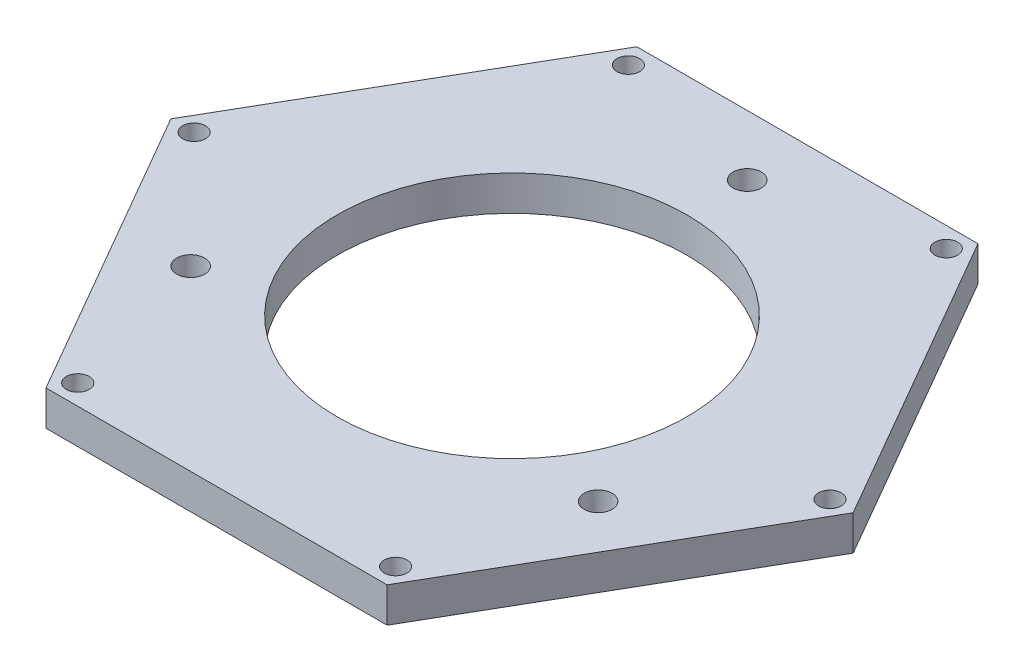
from build123d import *

# Parameters (mm, degrees)
BOSS_EXTRUDE1_DEPTH = 4
SKETCH3_R           = 20
CUT_EXTRUDE1_DEPTH  = 4
SKETCH4_R           = 1.6
SKETCH4_R_2         = 1.3
CUT_EXTRUDE2_DEPTH  = 4


with BuildPart() as part:
    # Sketch2 → Boss-Extrude1 (new body)
    with BuildSketch(Plane(origin=(0, 0, 0), x_dir=(1, 0, 0), z_dir=(0, 1, 0))):
        Polygon((1.572650536, 74.401195204), (-37.427349464, 74.401195204), (-56.927349464, 40.626204456), (-37.427349464, 6.851213708), (1.572650536, 6.851213708), (21.072650536, 40.626204456), align=None)
    extrude(amount=-BOSS_EXTRUDE1_DEPTH)

    # Sketch3 → Cut-Extrude1 (cut)
    with BuildSketch(Plane(origin=(0, 0, 0), x_dir=(1, 0, 0), z_dir=(0, 1, 0))):
        with Locations(Location((-17.927354806, 40.626195204, 0), (0, 0, 270))):
            Circle(SKETCH3_R)
    extrude(amount=-CUT_EXTRUDE1_DEPTH, mode=Mode.SUBTRACT)

    # Sketch4 → Cut-Extrude2 (cut)
    with BuildSketch(Plane(origin=(0, 0, 0), x_dir=(1, 0, 0), z_dir=(0, 1, 0))):
        with Locations(Location((5.360065631, 27.181209082, 0), (0, 0, 270))):
            Circle(SKETCH4_R)
        with Locations(Location((0.244744901, 9.15121368, 0), (0, 0, 270))):
            Circle(SKETCH4_R_2)
        with Locations(Location((-36.099443845, 9.151213708, 0), (0, 0, 270))):
            Circle(SKETCH4_R_2)
        with Locations(Location((-41.214764559, 27.181190577, 0), (0, 0, 270))):
            Circle(SKETCH4_R)
        with Locations(Location((-17.927365489, 67.516185951, 0), (0, 0, 270))):
            Circle(SKETCH4_R)
        with Locations(Location((18.416839298, 40.626204456, 0), (0, 0, 270))):
            Circle(SKETCH4_R_2)
        with Locations(Location((0.244744917, 72.101195204, 0), (0, 0, 270))):
            Circle(SKETCH4_R_2)
        with Locations(Location((-54.271538226, 40.626204456, 0), (0, 0, 270))):
            Circle(SKETCH4_R_2)
        with Locations(Location((-36.099443845, 72.101195204, 0), (0, 0, 270))):
            Circle(SKETCH4_R_2)
    extrude(amount=-CUT_EXTRUDE2_DEPTH, mode=Mode.SUBTRACT)


solid = part.part
